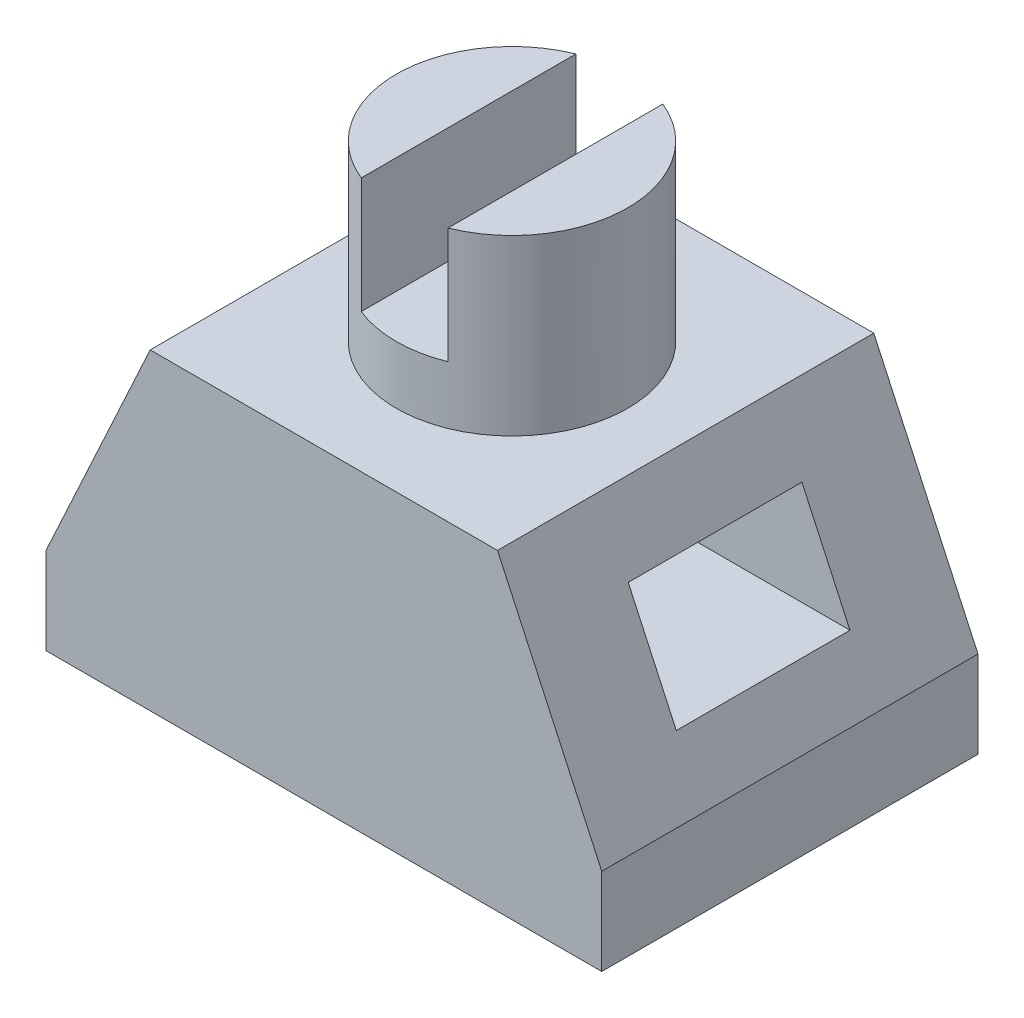
from build123d import *

# Parameters (mm, degrees)
EXTRUDE_2_DEPTH          = 32.5
CUT_EXTRUDE_1_DEPTH      = 64.947243881
CUT_EXTRUDE_1_DEPTH_BACK = 64.947243881
SKETCH_2_W               = 30
SKETCH_2_H               = 18
SKETCH_3_R               = 20
EXTRUDE_3_DEPTH          = 30
SKETCH_4_W               = 15
SKETCH_4_H               = 65
CUT_EXTRUDE_2_DEPTH      = 20


with BuildPart() as part:
    # Эскиз1 → Бобышка-Вытянуть2 (new, symmetric)
    with BuildSketch(Plane.XY):
        Polygon((-30, 27), (-48, -12), (-48, -27), (48, -27), (48, -12), (30, 27), align=None)
    extrude(amount=EXTRUDE_2_DEPTH, both=True)

    # Эскиз2 → Вырез-Вытянуть1 (cut, two sides: drawn at the far end of the back side and taken through both)
    with BuildSketch(Plane(origin=(0, 0, 0), x_dir=(0, 0, -1), z_dir=(1, 0, 0)).offset(-CUT_EXTRUDE_1_DEPTH_BACK)):
        with Locations((0, 7)):
            Rectangle(SKETCH_2_W, SKETCH_2_H)
    extrude(amount=CUT_EXTRUDE_1_DEPTH + CUT_EXTRUDE_1_DEPTH_BACK, mode=Mode.SUBTRACT)

    # Эскиз3 → Бобышка-Вытянуть3 (add)
    with BuildSketch(Plane(origin=(0, 27, 0), x_dir=(1, 0, 0), z_dir=(0, 1, 0))):
        with Locations(Location((0, 0, 0), (0, 0, 90))):
            Circle(SKETCH_3_R)
    extrude(amount=EXTRUDE_3_DEPTH)

    # Эскиз4 → Вырез-Вытянуть2 (cut)
    with BuildSketch(Plane(origin=(0, 57, 0), x_dir=(1, 0, 0), z_dir=(0, 1, 0))):
        Rectangle(SKETCH_4_W, SKETCH_4_H)
    extrude(amount=-CUT_EXTRUDE_2_DEPTH, mode=Mode.SUBTRACT)


solid = part.part
